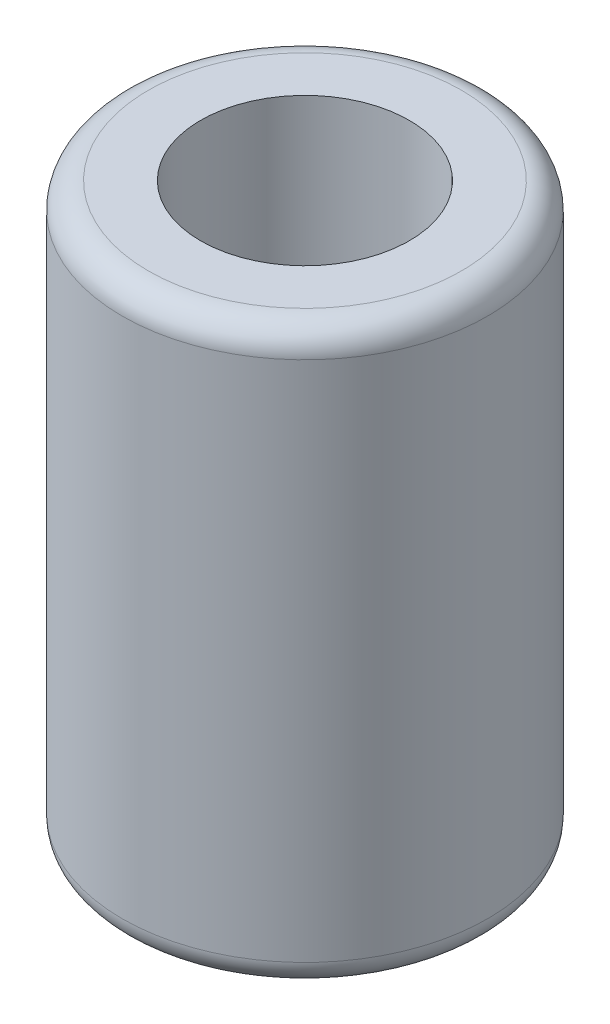
from build123d import *

# Parameters (mm, degrees)
SKETCH1_R           = 7
BOSS_EXTRUDE1_DEPTH = 22
SKETCH2_R           = 4
CUT_EXTRUDE1_DEPTH  = 25.124676164
FILLET1_R           = 1
FILLET2_R           = 1


with BuildPart() as part:
    # Sketch1 → Boss-Extrude1 (new body)
    with BuildSketch(Plane(origin=(0, 0, 0), x_dir=(1, 0, 0), z_dir=(0, 1, 0))):
        with Locations(Location((0, 0, 0), (0, 0, 270))):
            Circle(SKETCH1_R)
    extrude(amount=BOSS_EXTRUDE1_DEPTH)

    # Sketch2 → Cut-Extrude1 (cut, through all)
    with BuildSketch(Plane(origin=(0, 22, 0), x_dir=(1, 0, 0), z_dir=(0, 1, 0))):
        with Locations(Location((0, 0, 0), (0, 0, 270))):
            Circle(SKETCH2_R)
    extrude(amount=-CUT_EXTRUDE1_DEPTH, mode=Mode.SUBTRACT)

    # Fillet1
    fillet1_edges = [part.edges().sort_by_distance(p)[0] for p in [
        (0, 22, -7),
    ]]
    fillet(fillet1_edges, radius=FILLET1_R)

    # Fillet2
    fillet2_edges = [part.edges().sort_by_distance(p)[0] for p in [
        (0, 0, -7),
    ]]
    fillet(fillet2_edges, radius=FILLET2_R)


solid = part.part
